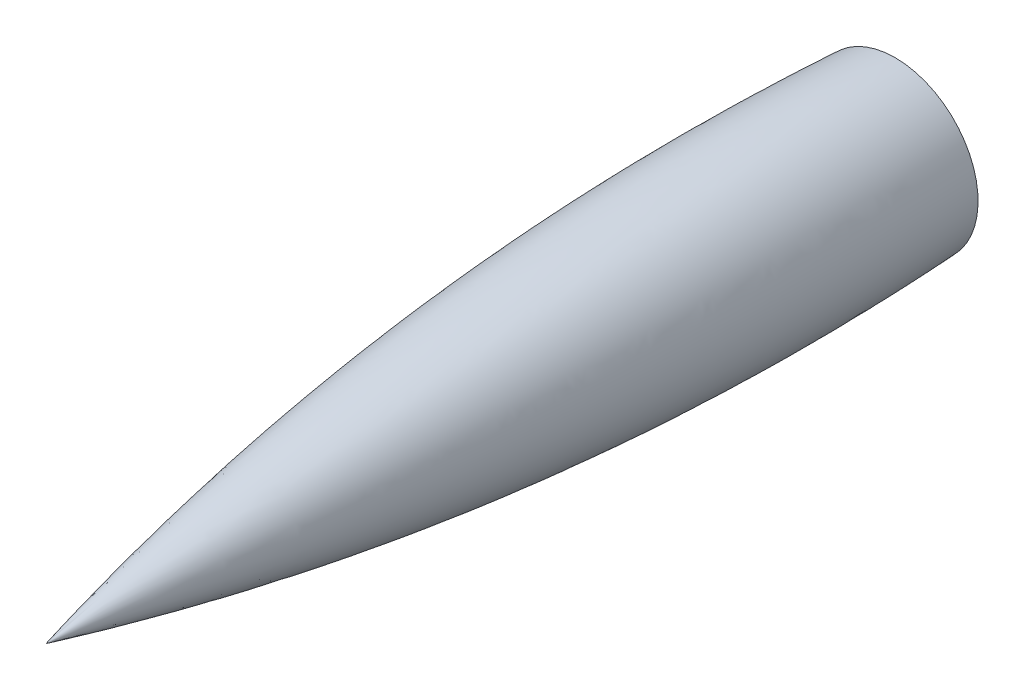
from build123d import *


with BuildPart() as part:
    # Sketch1 → Revolve1 (revolve)
    with BuildSketch(Plane(origin=(0, 0, 0), x_dir=(0, 0, -1), z_dir=(1, 0, 0))):
        with BuildLine():
            Line((0, 50.8), (0, 0))
            Line((0, 0), (-520.730801485, 0))
            add(Edge.make_bspline(
                [(-520.730801485, 0), (-520.093508427, 0.160648958), (-518.814891085, 0.482005609), (-515.934279565, 1.203842168), (-513.255046964, 1.867734188), (-510.067543281, 2.654006601), (-507.097949039, 3.379603733), (-504.030343387, 4.124163047), (-501.003922124, 4.85259613), (-497.197916542, 5.761749618), (-492.63750935, 6.839531368), (-485.786190065, 8.43736344), (-478.168296198, 10.175781809), (-470.540346312, 11.878448548), (-462.905486596, 13.544576368), (-456.792400492, 14.855823096), (-449.145585324, 16.467553727), (-439.960110351, 18.358054772), (-429.230890156, 20.49992397), (-416.951719189, 22.860326745), (-404.656073835, 25.133134866), (-386.188736482, 28.410805423), (-352.262040317, 34.01738786), (-308.919110013, 40.12609613), (-262.298591105, 45.233919616), (-221.789843552, 48.50662998), (-196.832812474, 50.105648187), (-181.226058866, 50.95673846), (-168.73610878, 51.548597505), (-156.242276319, 52.051414954), (-143.745144795, 52.465162548), (-131.245436, 52.789823751), (-118.743639036, 53.02537442), (-107.803524448, 53.153511137), (-98.425592114, 53.207626969), (-90.610917491, 53.215606741), (-84.358552701, 53.199674985), (-76.544665397, 53.151984168), (-68.728533355, 53.067024784), (-60.91717148, 52.945156536), (-53.100110818, 52.785822844), (-46.85638542, 52.6365744), (-40.594655893, 52.464076333), (-35.147649326, 52.295302247), (-30.429252213, 52.134096068), (-25.797558031, 51.966286123), (-21.000615579, 51.77864751), (-15.755387558, 51.561901756), (-9.9383327, 51.295618836), (-5.784812239, 51.097129408), (-1.953101165, 50.901586037), (-0.656325331, 50.834449658), (0, 50.8)],
                knots=[0.08339203, 0.08339203, 0.08339203, 0.08339203, 0.08339203, 0.08839795, 0.093403869, 0.098409789, 0.103415708, 0.108421628, 0.113427547, 0.118433466, 0.123439386, 0.133451213, 0.14346304, 0.163486695, 0.173498535, 0.183510375, 0.193522216, 0.203534056, 0.22355772, 0.243581383, 0.263605043, 0.283628702, 0.303652363, 0.363723376, 0.483865362, 0.563960022, 0.604007355, 0.624031019, 0.644054683, 0.664078349, 0.684102014, 0.70412568, 0.724149345, 0.744173007, 0.764196669, 0.774208502, 0.784220335, 0.794232169, 0.804244002, 0.824267667, 0.8342795, 0.844291333, 0.854303166, 0.864314999, 0.874326832, 0.879332749, 0.884338665, 0.894350495, 0.904362324, 0.914374154, 0.919380069, 0.924385983, 0.924385983, 0.924385983, 0.924385983, 0.924385983], degree=4))
        make_face()
    revolve(axis=Axis((0, 0, 0), (0, 0, 1)))


solid = part.part
